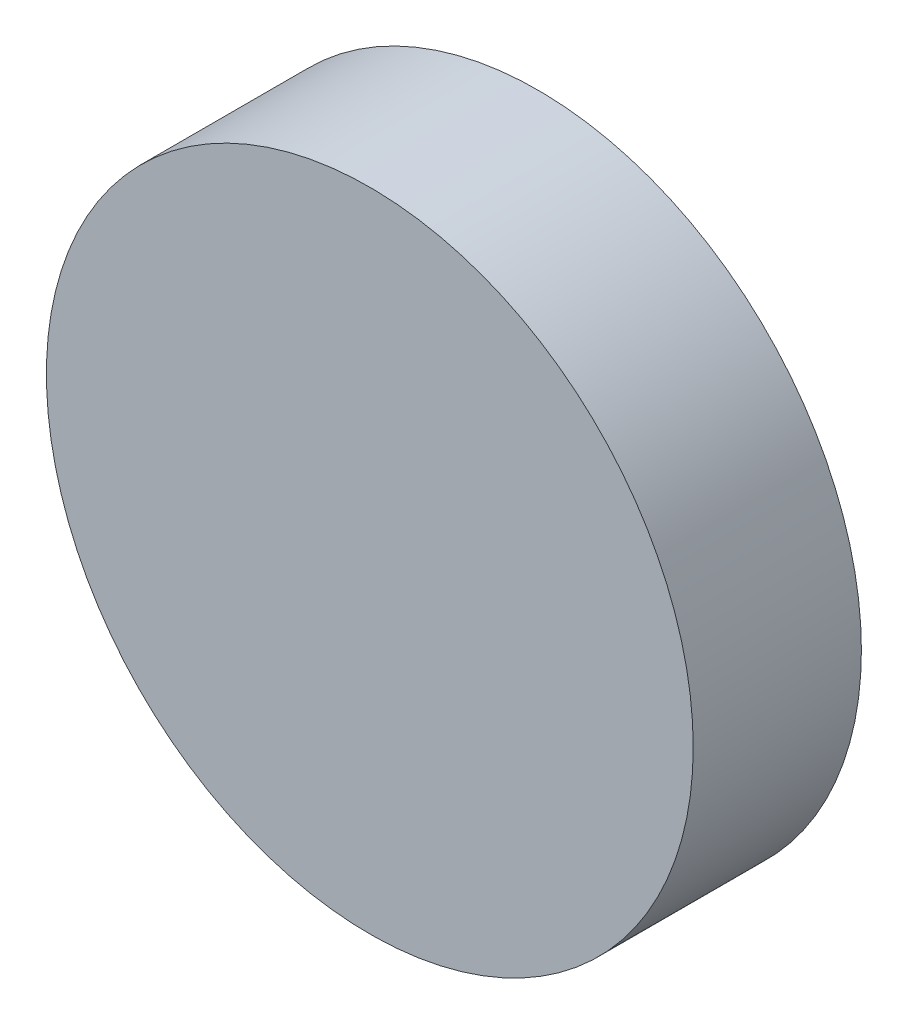
from build123d import *

# Parameters (mm, degrees)
SKETCH1_R           = 50
BOSS_EXTRUDE1_DEPTH = 26


with BuildPart() as part:
    # Sketch1 → Boss-Extrude1 (new body)
    with BuildSketch(Plane.XY):
        Circle(SKETCH1_R)
    extrude(amount=BOSS_EXTRUDE1_DEPTH)


solid = part.part
